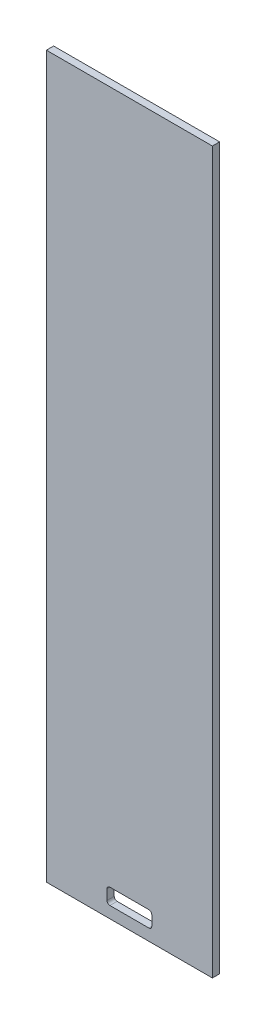
from build123d import *

# Parameters (mm, degrees)
SKETCH1_W           = 115
SKETCH1_H           = 499.2
BOSS_EXTRUDE1_DEPTH = 5
CUT_EXTRUDE1_REACH  = 504.526
SKETCH2_W           = 31
SKETCH2_H           = 11
FILLET1_R           = 2


with BuildPart() as part:
    # Sketch1 → Boss-Extrude1 (new body)
    with BuildSketch(Plane.XY):
        with Locations((0, 249.6)):
            Rectangle(SKETCH1_W, SKETCH1_H)
    extrude(amount=BOSS_EXTRUDE1_DEPTH)

    # Sketch2 → Cut-Extrude1 (cut, up to next)
    with BuildSketch(Plane.XY.offset(5), mode=Mode.PRIVATE) as cut_extrude1_sk1:
        with Locations((0, 13.5)):
            Rectangle(SKETCH2_W, SKETCH2_H)
    cut_extrude1_tool1 = extrude(cut_extrude1_sk1.sketch, amount=-CUT_EXTRUDE1_REACH, mode=Mode.PRIVATE) & part.part
    add(cut_extrude1_tool1.solids().sort_by_distance((0, 13.5, 5))[0], mode=Mode.SUBTRACT)

    # Fillet1
    fillet1_edges = [part.edges().sort_by_distance(p)[0] for p in [
        (-15.5, 8, 2.5),
        (-15.5, 19, 2.5),
        (15.5, 19, 2.5),
        (15.5, 8, 2.5),
    ]]
    fillet(fillet1_edges, radius=FILLET1_R)


solid = part.part
